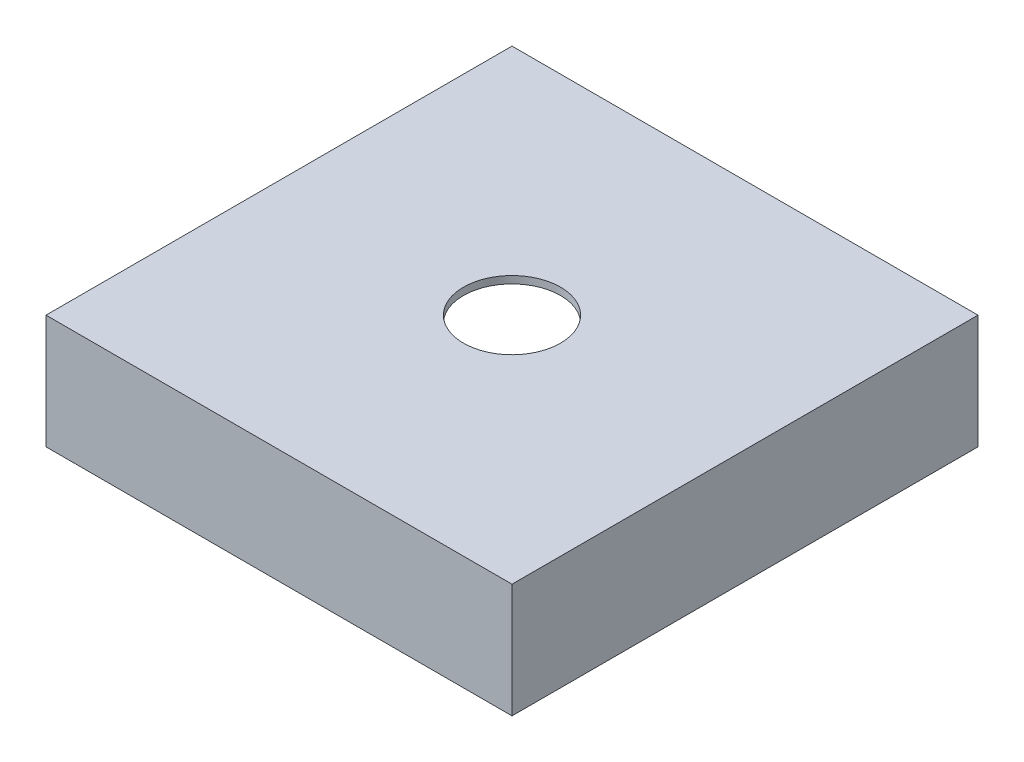
from build123d import *

# Parameters (mm, degrees)
SKETCH1_W           = 609.6
SKETCH1_H           = 609.6
SKETCH1_R           = 63.5
BOSS_EXTRUDE1_DEPTH = 9.525
BOSS_EXTRUDE2_DEPTH = 139.7


with BuildPart() as part:
    # Sketch1 → Boss-Extrude1 (new body)
    with BuildSketch(Plane(origin=(0, 0, 0), x_dir=(1, 0, 0), z_dir=(0, 1, 0))):
        with Locations((1894.49897269, -590.348674534)):
            Rectangle(SKETCH1_W, SKETCH1_H)
        with Locations(Location((1894.49897269, -590.348674534, 0), (0, 0, 90))):
            Circle(SKETCH1_R, mode=Mode.SUBTRACT)
    extrude(amount=BOSS_EXTRUDE1_DEPTH)

    # Sketch2 → Boss-Extrude2 (add)
    with BuildSketch(Plane.XZ):
        Polygon((1589.69897269, 323.648674534), (1589.69897269, 285.548674534), (1742.09897269, 285.548674534), (2046.89897269, 285.548674534), (2199.29897269, 285.548674534), (2199.29897269, 437.948674534), (2199.29897269, 742.748674534), (2199.29897269, 895.148674534), (2046.89897269, 895.148674534), (1742.09897269, 895.148674534), (1589.69897269, 895.148674534), (1589.69897269, 742.748674534), (1589.69897269, 437.948674534), align=None)
        Polygon((1742.09897269, 323.648674534), (1627.79897269, 323.648674534), (1627.79897269, 437.948674534), (1627.79897269, 742.748674534), (1627.79897269, 857.048674534), (1742.09897269, 857.048674534), (2046.89897269, 857.048674534), (2161.19897269, 857.048674534), (2161.19897269, 742.748674534), (2161.19897269, 437.948674534), (2161.19897269, 323.648674534), (2046.89897269, 323.648674534), align=None, mode=Mode.SUBTRACT)
    extrude(amount=BOSS_EXTRUDE2_DEPTH)


solid = part.part
